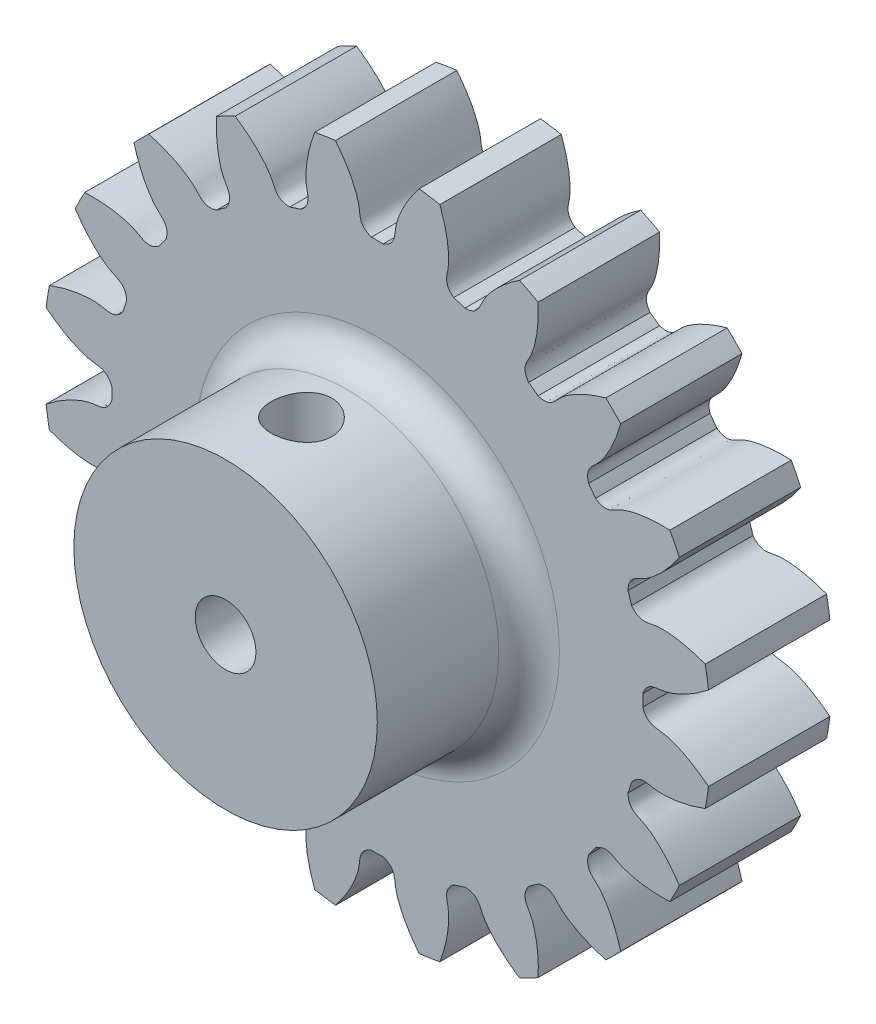
from build123d import *

# Parameters (mm, degrees)
SKETCH_1_R               = 11
EXTRUDE_1_DEPTH          = 4
CUT_EXTRUDE_1_DEPTH      = 17.062378404
PATTERN_CIRCULAR_1_COUNT = 20
SKETCH_5_R               = 5
EXTRUDE_2_DEPTH          = 5
CUT_EXTRUDE_2_DEPTH      = 18.866278615
CUT_EXTRUDE_2_DEPTH_BACK = 18.866278615
SKETCH_6_R               = 1
CUT_EXTRUDE_3_DEPTH      = 18.866278565
CUT_EXTRUDE_3_DEPTH_BACK = 18.866278565
SKETCH_7_R               = 1
FILLET_1_R               = 1


with BuildPart() as part:
    # 草图1 → 凸台-拉伸1 (new body)
    with BuildSketch(Plane.XY):
        Circle(SKETCH_1_R)
    extrude(amount=EXTRUDE_1_DEPTH)

    # 草图2 → 切除-拉伸1 (cut, through all)
    with BuildSketch(Plane.XY):
        with BuildLine():
            ThreePointArc((0.1933166, 8.747864236), (0, 8.75), (-0.1933166, 8.747864236))
            add(Edge.make_bspline(
                [(-0.1933166, 8.747864236), (-0.611189405, 8.893475512), (-0.557084099, 9.187113699), (-0.612897056, 9.470009403), (-0.618892186, 9.497556614), (-0.62631089, 9.528634615), (-0.635292097, 9.563196836), (-0.64597914, 9.601191497), (-0.658512055, 9.642562828), (-0.673029871, 9.687250733), (-0.68966975, 9.735190947), (-0.7085671, 9.786315045), (-0.729855399, 9.840550501), (-0.753666102, 9.897820731), (-0.780128531, 9.958045151), (-0.809369765, 10.021139231), (-0.841514533, 10.087014551), (-0.876685117, 10.155578861), (-0.915001238, 10.22673615), (-0.956579966, 10.300386704), (-1.001535609, 10.376427181), (-1.049979626, 10.454750678), (-1.102020521, 10.535246805), (-1.157763756, 10.617801764), (-1.217311651, 10.70229842), (-1.280763301, 10.78861639), (-1.34821448, 10.876632121), (-1.419757562, 10.966218973), (-1.495481426, 11.057247311), (-1.575471385, 11.149584594), (-1.659809097, 11.243095463), (-1.748572489, 11.337641835), (-1.841835684, 11.433083002), (-1.939668926, 11.529275727), (-2.042138506, 11.626074339), (-2.149306698, 11.723330842), (-2.261231689, 11.820895011), (-2.377967518, 11.918614499), (-2.499564012, 12.016334946), (-2.626066734, 12.113900082), (-2.757516899, 12.21115184), (-2.941473591, 12.341639868), (-3.083932413, 12.436332601), (-3.181157982, 12.49825186)],
                knots=[0, 0, 0, 0, 0.165916003, 0.170905922, 0.176663519, 0.183188797, 0.190481754, 0.198542391, 0.207370708, 0.216966704, 0.22733038, 0.238461736, 0.250360771, 0.263027487, 0.276461881, 0.290663956, 0.30563371, 0.321371144, 0.337876258, 0.355149051, 0.373189524, 0.391997677, 0.411573509, 0.431917021, 0.453028213, 0.474907084, 0.497553636, 0.520967867, 0.545149777, 0.570099367, 0.595816637, 0.622301587, 0.649554216, 0.677574526, 0.706362514, 0.735918183, 0.766241531, 0.797332559, 0.829191267, 0.861817654, 0.895211721, 0.929373468, 1, 1, 1, 1], degree=3))
            ThreePointArc((-3.181157982, 12.49825186), (0, 12.89674632), (3.181157982, 12.49825186))
            add(Edge.make_bspline(
                [(0.1933166, 8.747864236), (0.611189405, 8.893475512), (0.557084099, 9.187113699), (0.612897056, 9.470009403), (0.618892186, 9.497556614), (0.62631089, 9.528634615), (0.635292097, 9.563196836), (0.64597914, 9.601191497), (0.658512055, 9.642562828), (0.673029871, 9.687250733), (0.68966975, 9.735190947), (0.7085671, 9.786315045), (0.729855399, 9.840550501), (0.753666102, 9.897820731), (0.780128531, 9.958045151), (0.809369765, 10.021139231), (0.841514533, 10.087014551), (0.876685117, 10.155578861), (0.915001238, 10.22673615), (0.956579966, 10.300386704), (1.001535609, 10.376427181), (1.049979626, 10.454750678), (1.102020521, 10.535246805), (1.157763756, 10.617801764), (1.217311651, 10.70229842), (1.280763301, 10.78861639), (1.34821448, 10.876632121), (1.419757562, 10.966218973), (1.495481426, 11.057247311), (1.575471385, 11.149584594), (1.659809097, 11.243095463), (1.748572489, 11.337641835), (1.841835684, 11.433083002), (1.939668926, 11.529275727), (2.042138506, 11.626074339), (2.149306698, 11.723330842), (2.261231689, 11.820895011), (2.377967518, 11.918614499), (2.499564012, 12.016334946), (2.626066734, 12.113900082), (2.757516899, 12.21115184), (2.941473591, 12.341639868), (3.083932413, 12.436332601), (3.181157982, 12.49825186)],
                knots=[0, 0, 0, 0, 0.165916003, 0.170905922, 0.176663519, 0.183188797, 0.190481754, 0.198542391, 0.207370708, 0.216966704, 0.22733038, 0.238461736, 0.250360771, 0.263027487, 0.276461881, 0.290663956, 0.30563371, 0.321371144, 0.337876258, 0.355149051, 0.373189524, 0.391997677, 0.411573509, 0.431917021, 0.453028213, 0.474907084, 0.497553636, 0.520967867, 0.545149777, 0.570099367, 0.595816637, 0.622301587, 0.649554216, 0.677574526, 0.706362514, 0.735918183, 0.766241531, 0.797332559, 0.829191267, 0.861817654, 0.895211721, 0.929373468, 1, 1, 1, 1], degree=3))
        make_face()
    cut_extrude_1 = extrude(amount=CUT_EXTRUDE_1_DEPTH, mode=Mode.SUBTRACT)

    # 阵列(圆周)1: 切除-拉伸1 ×20 about axis
    pattern_circular_1_axis = Axis((0, 0, -0.15), (0, 0, 1))
    for i in range(1, PATTERN_CIRCULAR_1_COUNT):
        add(cut_extrude_1.rotate(pattern_circular_1_axis, i * 360 / PATTERN_CIRCULAR_1_COUNT), mode=Mode.SUBTRACT)

    # 草图5 → 凸台-拉伸2 (add)
    with BuildSketch(Plane.XY.offset(4)):
        Circle(SKETCH_5_R)
    extrude(amount=EXTRUDE_2_DEPTH)

    # 草图6 → 切除-拉伸2 (cut, two sides: drawn at the far end of the back side and taken through both)
    with BuildSketch(Plane.XY.offset(9).offset(-CUT_EXTRUDE_2_DEPTH_BACK)):
        Circle(SKETCH_6_R)
    extrude(amount=CUT_EXTRUDE_2_DEPTH + CUT_EXTRUDE_2_DEPTH_BACK, mode=Mode.SUBTRACT)

    # 草图7 → 切除-拉伸3 (cut, two sides: drawn at the far end of the back side and taken through both)
    with BuildSketch(Plane(origin=(0, 0, 0), x_dir=(1, 0, 0), z_dir=(0, 1, 0)).offset(-CUT_EXTRUDE_3_DEPTH_BACK)):
        with Locations((0, -6.5)):
            Circle(SKETCH_7_R)
    extrude(amount=CUT_EXTRUDE_3_DEPTH + CUT_EXTRUDE_3_DEPTH_BACK, mode=Mode.SUBTRACT)

    # 圆角1
    fillet_1_edges = [part.edges().sort_by_distance(p)[0] for p in [
        (-5, 0, 4),
    ]]
    fillet(fillet_1_edges, radius=FILLET_1_R)


solid = part.part
